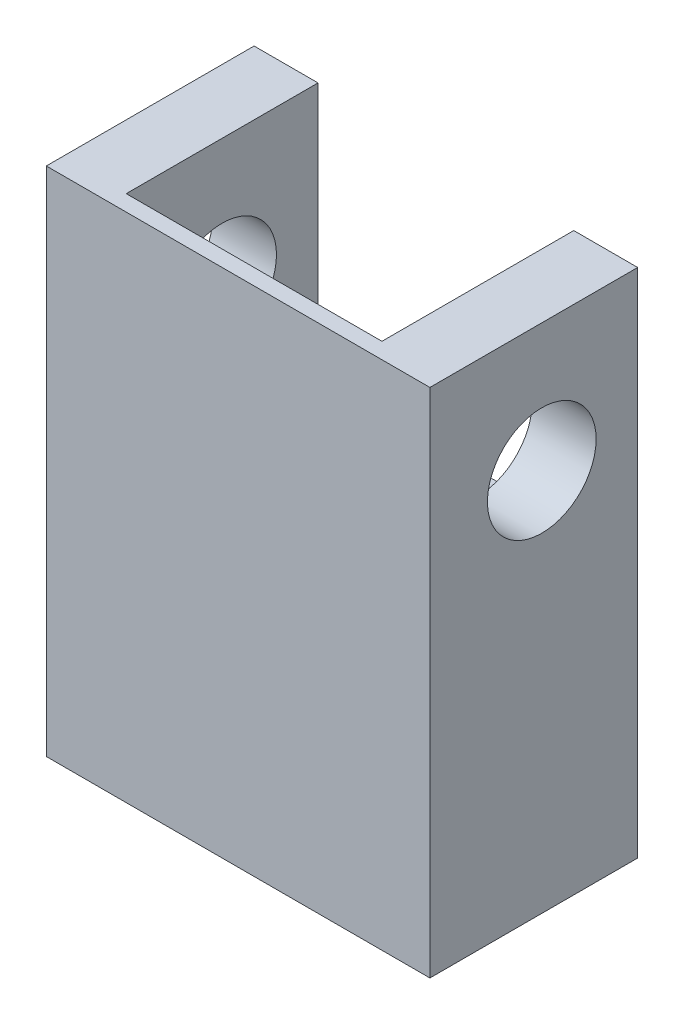
from build123d import *

# Parameters (mm, degrees)
BOSS_EXTRUDE1_DEPTH     = 19.05
CUT_EXTRUDE1_DEPTH      = 111.168382488
CUT_EXTRUDE1_DEPTH_BACK = 111.168382488
SKETCH2_R               = 10.795
SKETCH3_W               = 76.2
SKETCH3_H               = 101.6
BOSS_EXTRUDE2_DEPTH     = 3.175


with BuildPart() as part:
    # Sketch1 → Boss-Extrude1 (new, symmetric)
    with BuildSketch(Plane.XY):
        Polygon((-38.1, 0), (38.1, 0), (38.1, 101.6), (25.4, 101.6), (25.4, 50.8), (-25.4, 50.8), (-25.4, 101.6), (-38.1, 101.6), align=None)
    extrude(amount=BOSS_EXTRUDE1_DEPTH, both=True)

    # Sketch2 → Cut-Extrude1 (cut, two sides: drawn at the far end of the back side and taken through both)
    with BuildSketch(Plane(origin=(0, 0, 0), x_dir=(0, 0, -1), z_dir=(1, 0, 0)).offset(-CUT_EXTRUDE1_DEPTH_BACK)):
        with Locations((0, 76.2)):
            Circle(SKETCH2_R)
    extrude(amount=CUT_EXTRUDE1_DEPTH + CUT_EXTRUDE1_DEPTH_BACK, mode=Mode.SUBTRACT)

    # Sketch3 → Boss-Extrude2 (add)
    with BuildSketch(Plane.XY.offset(19.05)):
        with Locations((0, 50.8)):
            Rectangle(SKETCH3_W, SKETCH3_H)
    extrude(amount=BOSS_EXTRUDE2_DEPTH)


solid = part.part
